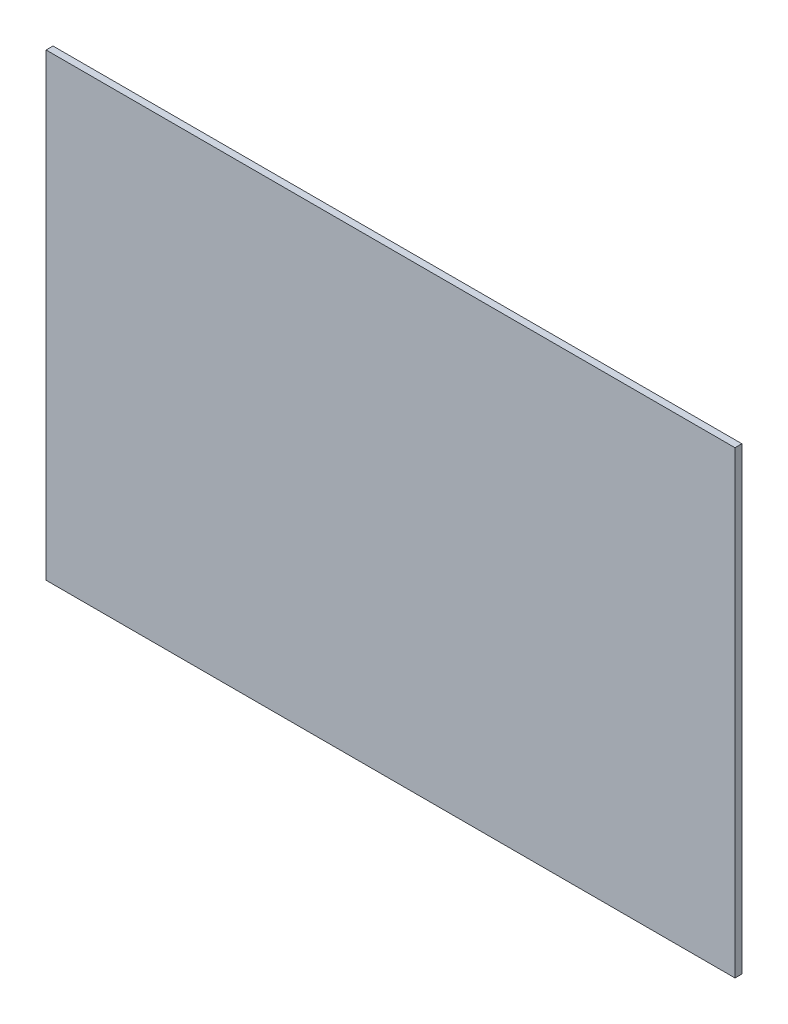
from build123d import *

# Parameters (mm, degrees)
SKETCH_1_W      = 300
SKETCH_1_H      = 200
EXTRUDE_1_DEPTH = 3


with BuildPart() as part:
    # Эскиз1 → Бобышка-Вытянуть1 (new body)
    with BuildSketch(Plane.XY):
        Rectangle(SKETCH_1_W, SKETCH_1_H)
    extrude(amount=EXTRUDE_1_DEPTH)


solid = part.part
